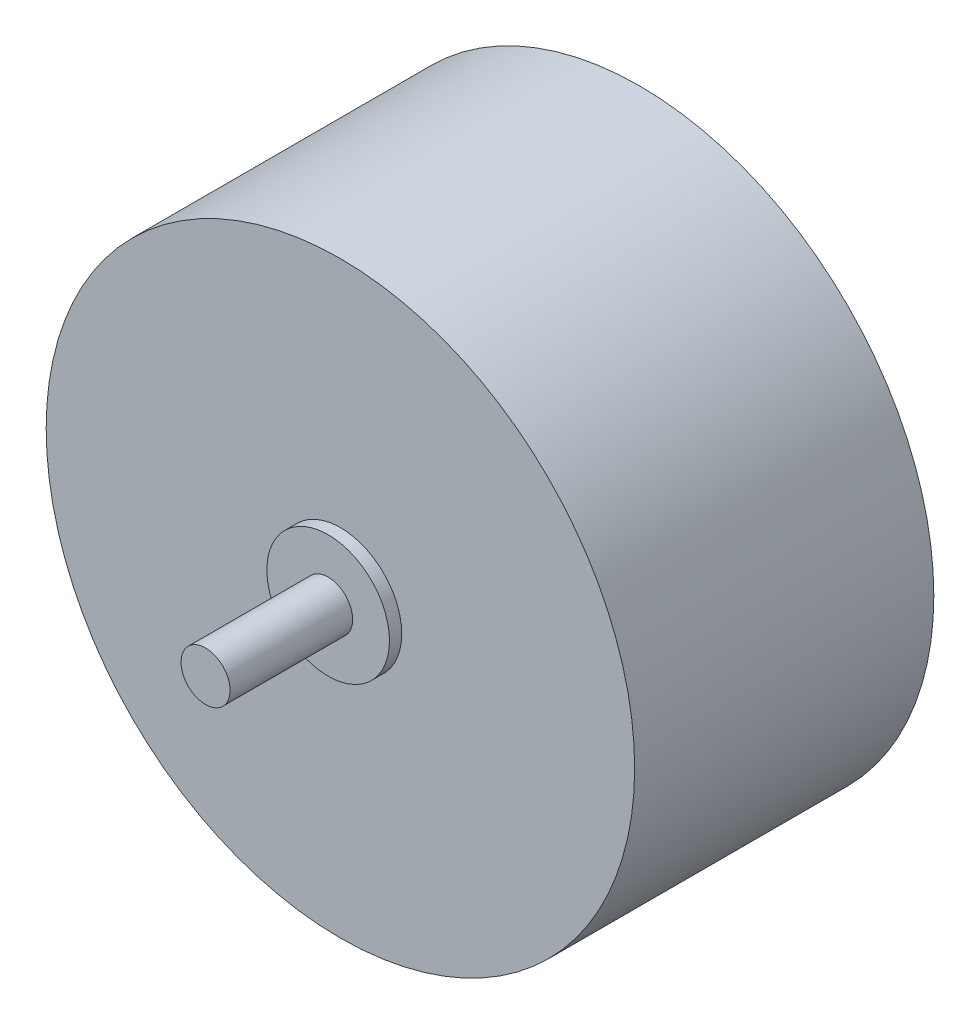
from build123d import *

# Parameters (mm, degrees)
SKETCH1_R           = 12
BOSS_EXTRUDE1_DEPTH = 12.2
SKETCH2_R           = 2.5
BOSS_EXTRUDE2_DEPTH = 0.5
SKETCH3_R           = 1
BOSS_EXTRUDE3_DEPTH = 5


with BuildPart() as part:
    # Sketch1 → Boss-Extrude1 (new body)
    with BuildSketch(Plane.XY):
        Circle(SKETCH1_R)
    extrude(amount=BOSS_EXTRUDE1_DEPTH)

    # Sketch2 → Boss-Extrude2 (add)
    with BuildSketch(Plane.XY.offset(12.2)):
        Circle(SKETCH2_R)
    extrude(amount=BOSS_EXTRUDE2_DEPTH)

    # Sketch3 → Boss-Extrude3 (add)
    with BuildSketch(Plane.XY.offset(12.7)):
        Circle(SKETCH3_R)
    extrude(amount=BOSS_EXTRUDE3_DEPTH)


solid = part.part
